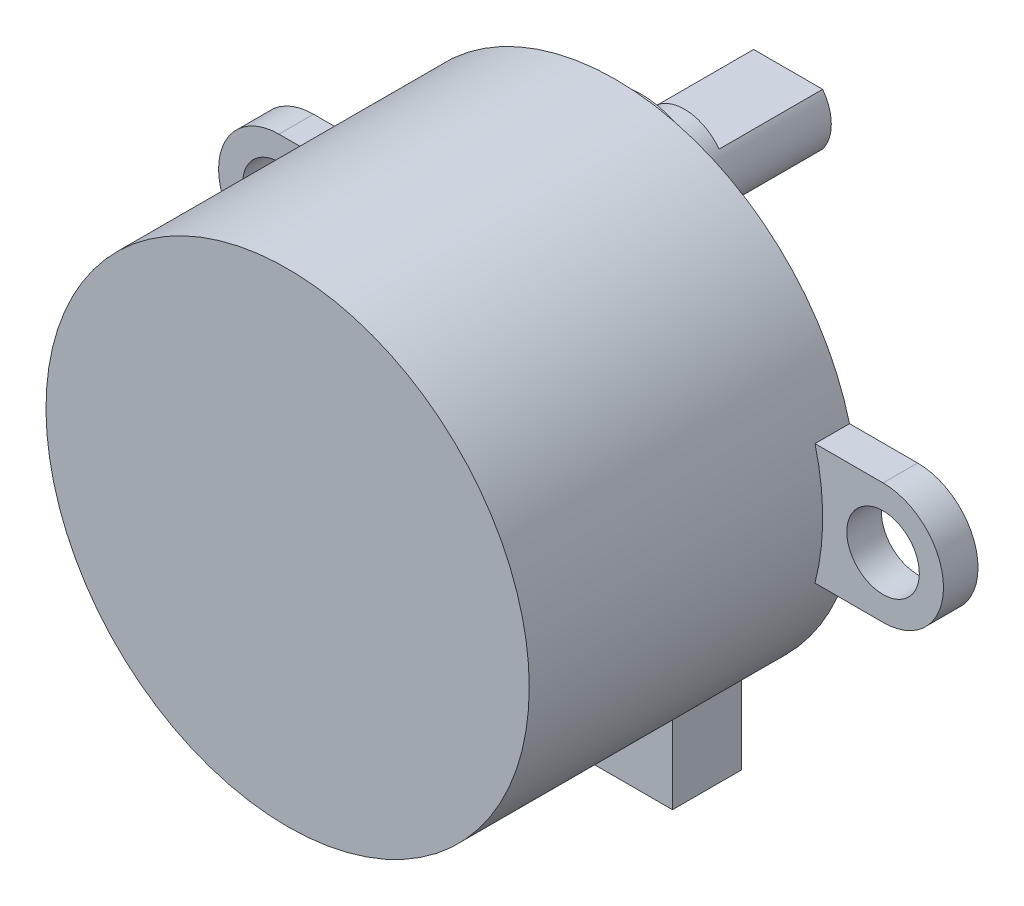
from build123d import *

# Parameters (mm, degrees)
SKETCH2_R           = 14
BOSS_EXTRUDE1_DEPTH = 19
SKETCH2_3_R         = 2.1
BOSS_EXTRUDE2_DEPTH = 2
BOSS_EXTRUDE3_DEPTH = 4
SKETCH3_R           = 4.5
BOSS_EXTRUDE4_DEPTH = 1.5
SKETCH5_R           = 2.5
BOSS_EXTRUDE5_DEPTH = 10
CUT_EXTRUDE1_START  = -6
CUT_EXTRUDE1_DEPTH  = 6


with BuildPart() as part:
    # Sketch2 → Boss-Extrude1 (new body)
    with BuildSketch(Plane.XY):
        Circle(SKETCH2_R)
    extrude(amount=BOSS_EXTRUDE1_DEPTH)

    # Sketch2<3> → Boss-Extrude2 (add)
    with BuildSketch(Plane.XY):
        with BuildLine():
            ThreePointArc((17.5, -3.5), (21, 0), (17.5, 3.5))
            Line((17.5, 3.5), (13.555441712, 3.5))
            ThreePointArc((13.555441712, 3.5), (13.888415748, 1.764060095), (14, 0))
            ThreePointArc((14, 0), (13.888415748, -1.764060095), (13.555441712, -3.5))
            Line((13.555441712, -3.5), (17.5, -3.5))
        make_face()
        with Locations((17.5, 0)):
            Circle(SKETCH2_3_R, mode=Mode.SUBTRACT)
    boss_extrude2 = extrude(amount=BOSS_EXTRUDE2_DEPTH)

    # Mirror1: Boss-Extrude2 across plane
    add(boss_extrude2.mirror(Plane(origin=(0, 0, 0), x_dir=(0, 0, 1), z_dir=(1, 0, 0))))

    # Sketch2<4> → Boss-Extrude3 (add)
    with BuildSketch(Plane.XY):
        with BuildLine():
            ThreePointArc((7.3, -11.94612908), (0, -14), (-7.3, -11.94612908))
            Line((-7.3, -11.94612908), (-7.3, -17))
            Line((-7.3, -17), (7.3, -17))
            Line((7.3, -17), (7.3, -11.94612908))
        make_face()
    extrude(amount=BOSS_EXTRUDE3_DEPTH)

    # Sketch3 → Boss-Extrude4 (add)
    with BuildSketch(Plane.XY):
        with Locations((0, 8)):
            Circle(SKETCH3_R)
    extrude(amount=-BOSS_EXTRUDE4_DEPTH)

    # Sketch5 → Boss-Extrude5 (add)
    with BuildSketch(Plane.XY):
        with Locations((0, 8)):
            Circle(SKETCH5_R)
    extrude(amount=-BOSS_EXTRUDE5_DEPTH)

    # Sketch7 → Cut-Extrude1 (cut)
    with BuildSketch(Plane(origin=(0, 0, -10), x_dir=(-1, 0, 0), z_dir=(0, 0, -1)).offset(CUT_EXTRUDE1_START)):
        with BuildLine():
            ThreePointArc((-2, 6.5), (0, 5.5), (2, 6.5))
            Line((2, 6.5), (-2, 6.5))
        make_face()
        with BuildLine():
            ThreePointArc((2, 9.5), (0, 10.5), (-2, 9.5))
            Line((-2, 9.5), (2, 9.5))
        make_face()
    extrude(amount=CUT_EXTRUDE1_DEPTH, mode=Mode.SUBTRACT)


solid = part.part
